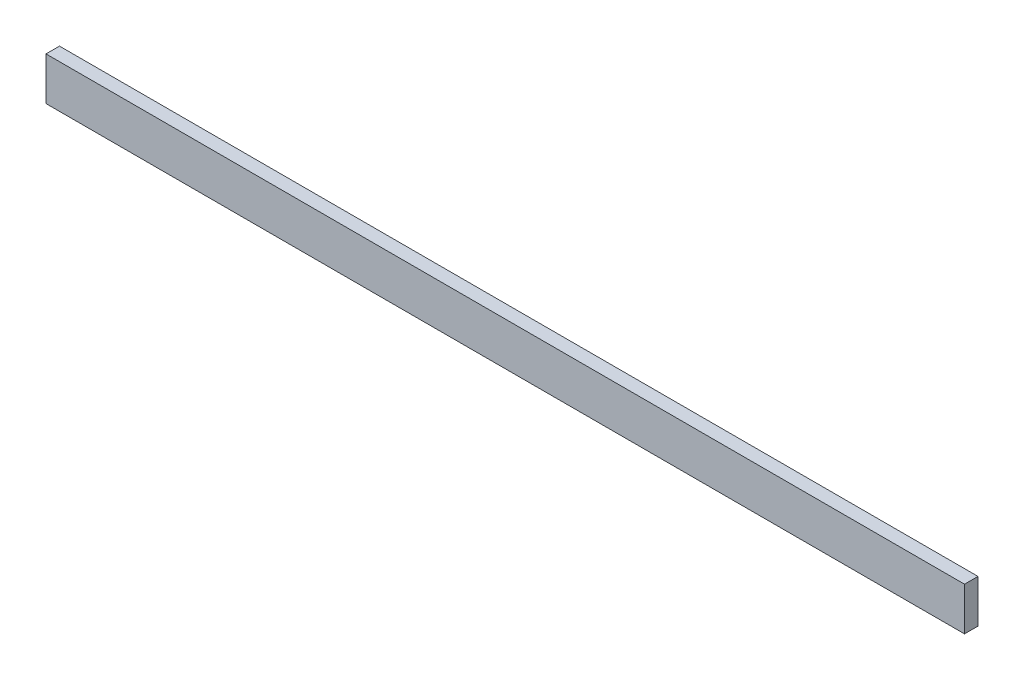
from build123d import *

# Parameters (mm, degrees)
SKETCH1_W           = 47
SKETCH1_H           = 150
BOSS_EXTRUDE1_DEPTH = 3200


with BuildPart() as part:
    # Sketch1 → Boss-Extrude1 (new body)
    with BuildSketch(Plane(origin=(0, 0, 0), x_dir=(0, 0, -1), z_dir=(1, 0, 0))):
        Rectangle(SKETCH1_W, SKETCH1_H)
    extrude(amount=BOSS_EXTRUDE1_DEPTH)


solid = part.part
